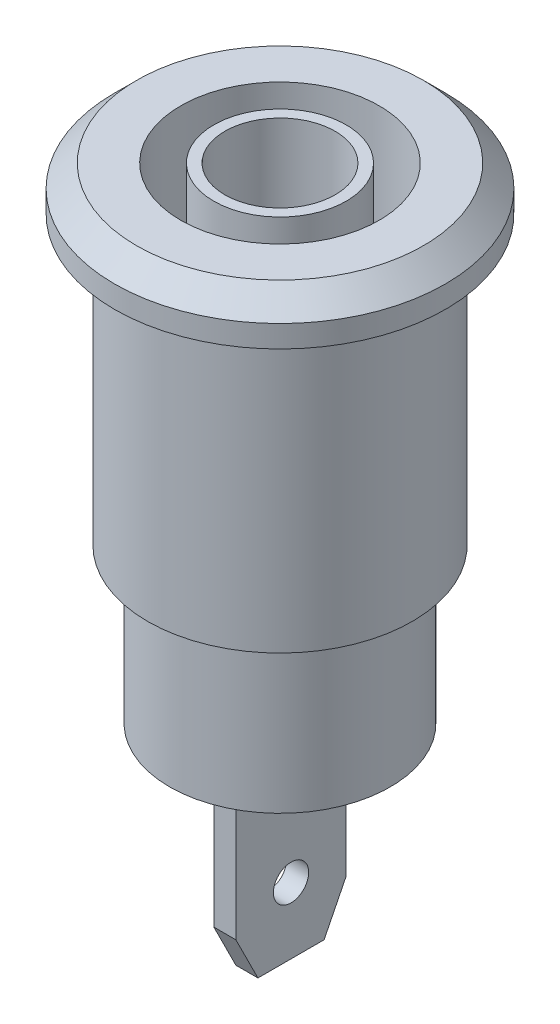
from build123d import *

# Parameters (mm, degrees)
CHANFREIN1_SIZE         = 1
ESQUISSE2_R             = 4.5
ENL_V_MAT_EXTRU_1_DEPTH = 12
ESQUISSE3_R             = 3
BOSS_EXTRU_1_DEPTH      = 12
ESQUISSE4_R             = 2.5
ENL_V_MAT_EXTRU_2_DEPTH = 12
ESQUISSE5_W             = 5
ESQUISSE5_H             = 9
BOSS_EXTRU_2_DEPTH      = 1
ENL_V_MAT_EXTRU_3_DEPTH = 1
ENL_V_MAT_EXTRU_4_DEPTH = 1
ESQUISSE8_R             = 0.8
ENL_V_MAT_EXTRU_5_DEPTH = 1


with BuildPart() as part:
    # Esquisse1 → Base-Révolution (revolve)
    with BuildSketch(Plane(origin=(0, 0, 0), x_dir=(0, 0, -1), z_dir=(1, 0, 0)), mode=Mode.PRIVATE) as base_r_volution_sk:
        Polygon((0, 0), (7.5, 0), (7.5, -2), (6, -2), (6, -15), (5, -15), (5, -22), (0, -22), align=None)
    revolve(base_r_volution_sk.sketch.rotate(Axis((0, 10, 0), (0, -1, 0)), 180), axis=Axis((0, 10, 0), (0, -1, 0)))

    # Chanfrein1
    chanfrein1_edges = [part.edges().sort_by_distance(p)[0] for p in [
        (0, 0, -7.5),
    ]]
    chamfer(chanfrein1_edges, length=CHANFREIN1_SIZE)

    # Esquisse2 → Enlèv. mat.-Extru.1 (cut)
    with BuildSketch(Plane(origin=(0, 0, 0), x_dir=(-1, 0, 0), z_dir=(0, 1, 0))):
        with Locations(Location((0, 0, 0), (0, 0, 90))):
            Circle(ESQUISSE2_R)
    extrude(amount=-ENL_V_MAT_EXTRU_1_DEPTH, mode=Mode.SUBTRACT)

    # Esquisse3 → Boss.-Extru.1 (add)
    with BuildSketch(Plane(origin=(0, -12, 0), x_dir=(-1, 0, 0), z_dir=(0, 1, 0))):
        with Locations(Location((0, 0, 0), (0, 0, 90))):
            Circle(ESQUISSE3_R)
    extrude(amount=BOSS_EXTRU_1_DEPTH)

    # Esquisse4 → Enlèv. mat.-Extru.2 (cut)
    with BuildSketch(Plane(origin=(0, 0, 0), x_dir=(-1, 0, 0), z_dir=(0, 1, 0))):
        with Locations(Location((0, 0, 0), (0, 0, 90))):
            Circle(ESQUISSE4_R)
    extrude(amount=-ENL_V_MAT_EXTRU_2_DEPTH, mode=Mode.SUBTRACT)

    # Esquisse5 → Boss.-Extru.2 (add)
    with BuildSketch(Plane(origin=(0.5, 0, 0), x_dir=(0, 0, -1), z_dir=(1, 0, 0))):
        with Locations((0, -26.5)):
            Rectangle(ESQUISSE5_W, ESQUISSE5_H)
    extrude(amount=-BOSS_EXTRU_2_DEPTH)

    # Esquisse6 → Enlèv. mat.-Extru.3 (cut)
    with BuildSketch(Plane(origin=(0.5, 0, 0), x_dir=(0, 0, -1), z_dir=(1, 0, 0))):
        Polygon((-2.5, -29), (-1.5, -31), (-2.5, -31), align=None)
    extrude(amount=-ENL_V_MAT_EXTRU_3_DEPTH, mode=Mode.SUBTRACT)

    # Esquisse7 → Enlèv. mat.-Extru.4 (cut)
    with BuildSketch(Plane(origin=(0.5, 0, 0), x_dir=(0, 0, -1), z_dir=(1, 0, 0))):
        Polygon((2.5, -31), (2.5, -29), (1.5, -31), align=None)
    extrude(amount=-ENL_V_MAT_EXTRU_4_DEPTH, mode=Mode.SUBTRACT)

    # Esquisse8 → Enlèv. mat.-Extru.5 (cut)
    with BuildSketch(Plane(origin=(0.5, 0, 0), x_dir=(0, 0, -1), z_dir=(1, 0, 0))):
        with Locations((0, -28)):
            Circle(ESQUISSE8_R)
    extrude(amount=-ENL_V_MAT_EXTRU_5_DEPTH, mode=Mode.SUBTRACT)


solid = part.part
